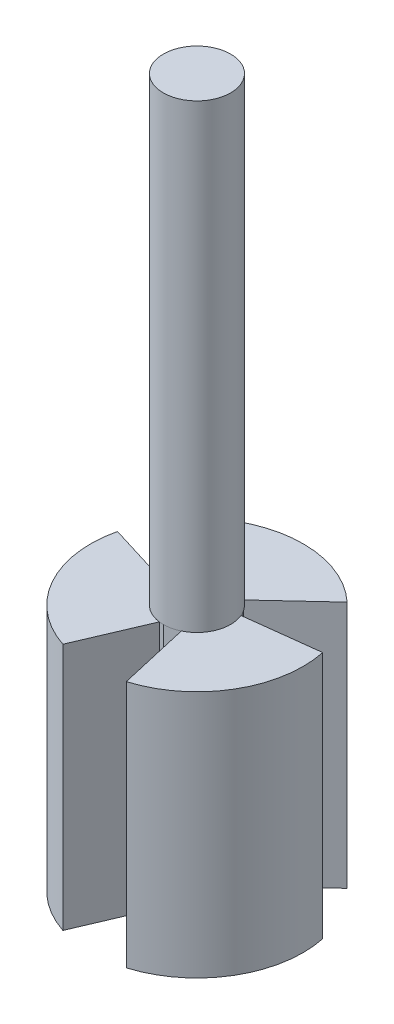
from build123d import *

# Parameters (mm, degrees)
SKETCH1_R           = 9.5
BOSS_EXTRUDE1_DEPTH = 200
SKETCH2_R           = 30
SKETCH2_R_2         = 9.5
BOSS_EXTRUDE2_DEPTH = 70
CUT_EXTRUDE1_DEPTH  = 137.747943312
CIRPATTERN1_COUNT   = 3


with BuildPart() as part:
    # Sketch1 → Boss-Extrude1 (new body)
    with BuildSketch(Plane(origin=(0, 0, 0), x_dir=(1, 0, 0), z_dir=(0, 1, 0))):
        with Locations(Location((0, 0, 0), (0, 0, 270))):
            Circle(SKETCH1_R)
    extrude(amount=BOSS_EXTRUDE1_DEPTH)

    # Sketch2 → Boss-Extrude2 (add)
    with BuildSketch(Plane.XZ):
        with Locations(Location((0, 0, 0), (0, 0, 270))):
            Circle(SKETCH2_R)
        with Locations(Location((0, 0, 0), (0, 0, 270))):
            Circle(SKETCH2_R_2, mode=Mode.SUBTRACT)
    extrude(amount=-BOSS_EXTRUDE2_DEPTH)

    # Sketch4 → Cut-Extrude1 (cut, through all)
    with BuildSketch(Plane(origin=(0, 70, 0), x_dir=(1, 0, 0), z_dir=(0, 1, 0))):
        Polygon((-10.93957563, -32.202671167), (-1.213017348, -9.422239061), (0, -9.5), (4.133811434, -8.553455619), (9.548918641, -32.202671167), align=None)
    cut_extrude1 = extrude(amount=-CUT_EXTRUDE1_DEPTH, mode=Mode.SUBTRACT)

    # CirPattern1: Cut-Extrude1 ×3 about axis
    cirpattern1_axis = Axis((0, 0, 0), (0, 1, 0))
    for i in range(1, CIRPATTERN1_COUNT):
        add(cut_extrude1.rotate(cirpattern1_axis, i * 360 / CIRPATTERN1_COUNT), mode=Mode.SUBTRACT)


solid = part.part
